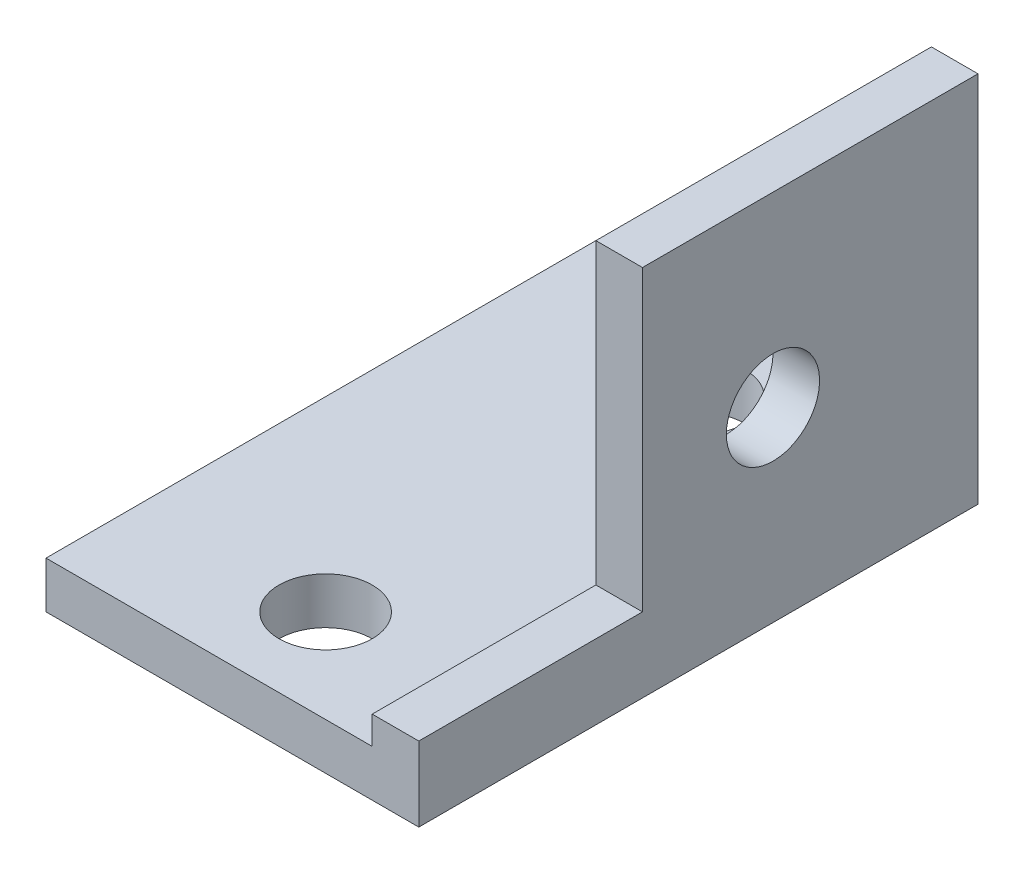
from build123d import *

# Parameters (mm, degrees)
SKETCH1_W           = 22.225
SKETCH1_H           = 38.1
SKETCH1_R           = 3.175
BOSS_EXTRUDE1_DEPTH = 3.175
SKETCH2_W           = 3.175
SKETCH2_H           = 38.1
BOSS_EXTRUDE2_DEPTH = 25.4
SKETCH3_R           = 3.175
SKETCH3_W           = 15.24
SKETCH3_H           = 20.32
CUT_EXTRUDE1_DEPTH  = 39.75581408


with BuildPart() as part:
    # Sketch1 → Boss-Extrude1 (new body)
    with BuildSketch(Plane(origin=(0, 0, 0), x_dir=(1, 0, 0), z_dir=(0, 1, 0))):
        Rectangle(SKETCH1_W, SKETCH1_H)
        with Locations(Location((1.5875, 12.7, 0), (0, 0, 270))):
            Circle(SKETCH1_R, mode=Mode.SUBTRACT)
        with Locations(Location((1.5875, -12.7, 0), (0, 0, 270))):
            Circle(SKETCH1_R, mode=Mode.SUBTRACT)
    extrude(amount=BOSS_EXTRUDE1_DEPTH)

    # Sketch2 → Boss-Extrude2 (add)
    with BuildSketch(Plane(origin=(0, 0, 0), x_dir=(1, 0, 0), z_dir=(0, 1, 0))):
        with Locations((12.7, 0)):
            Rectangle(SKETCH2_W, SKETCH2_H)
    extrude(amount=BOSS_EXTRUDE2_DEPTH)

    # Sketch3 → Cut-Extrude1 (cut, through all)
    with BuildSketch(Plane.ZY.offset(-11.1125)):
        with Locations((-5.08, 12.7)):
            Circle(SKETCH3_R)
        with Locations((11.43, 15.24)):
            Rectangle(SKETCH3_W, SKETCH3_H)
    extrude(amount=-CUT_EXTRUDE1_DEPTH, mode=Mode.SUBTRACT)


solid = part.part
